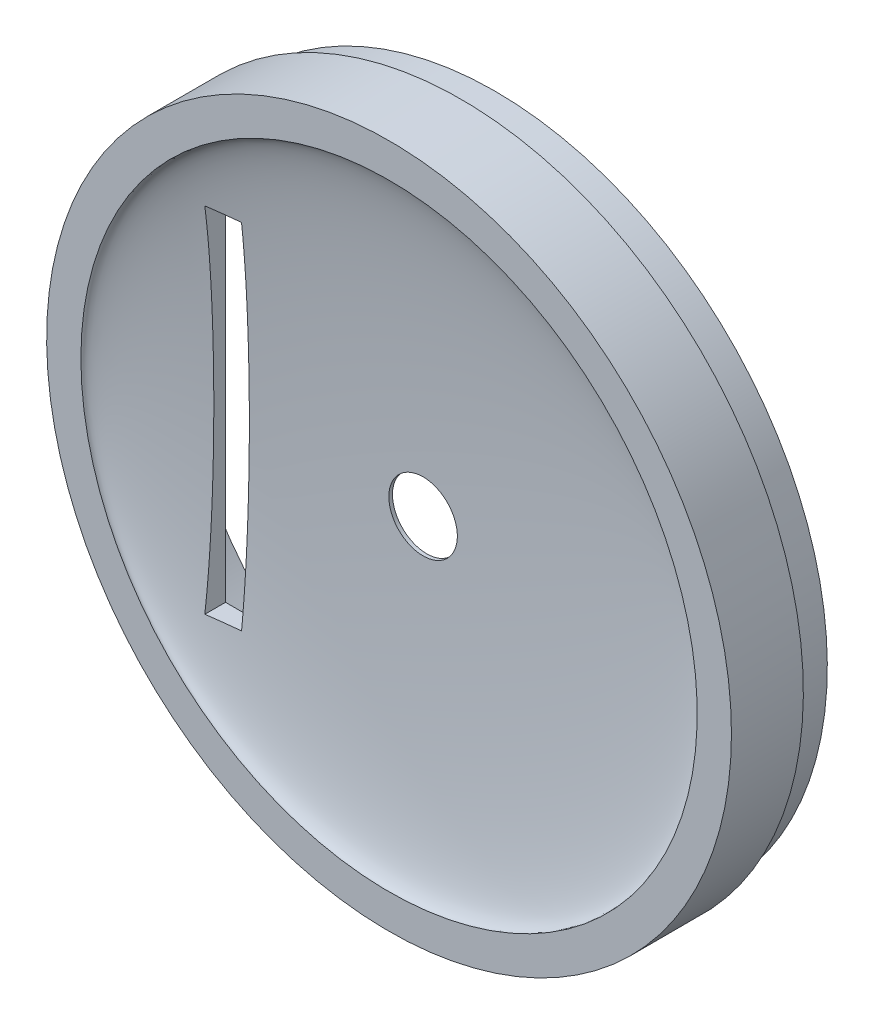
from build123d import *

# Parameters (mm, degrees)
SKETCH_1_R          = 100
EXTRUDE_5_DEPTH     = 10
EXTRUDE_START       = -1
SKETCH_9_R          = 100
EXTRUDE_7_DEPTH     = 1
EXTRUDE_START_2     = 10
SKETCH_11_R         = 100
SKETCH_11_R_2       = 95
EXTRUDE_8_DEPTH     = 10
SKETCH_12_R         = 97
SKETCH_12_R_2       = 95
EXTRUDE_9_DEPTH     = 10
SKETCH_14_R         = 10
SKETCH_14_W         = 9.580387857
SKETCH_14_H         = 103.308515728
CUT_EXTRUDE_4_DEPTH = 20
SKETCH_17_W         = 14.435902612
SKETCH_17_H         = 11
CUT_EXTRUDE_5_DEPTH = 20


with BuildPart() as part:
    # 草图1 → 凸台-拉伸5 (new body)
    with BuildSketch(Plane.XY):
        Circle(SKETCH_1_R)
    extrude(amount=EXTRUDE_5_DEPTH)

    # 草图9 → 凸台-拉伸7 (add)
    with BuildSketch(Plane.XY.offset(EXTRUDE_START)):
        Circle(SKETCH_9_R)
    extrude(amount=EXTRUDE_7_DEPTH)

    # 草图7 → 切除-旋转2 (revolve, cut)
    with BuildSketch(Plane(origin=(0, 0, 0), x_dir=(1, 0, 0), z_dir=(0, 1, 0))):
        with BuildLine():
            Line((0, 0), (0, -10))
            Line((0, -10), (-90, -10))
            add(Edge.make_bspline(
                [(0, 0), (-90, 0), (-90, -10)],
                knots=[1.570796327, 1.570796327, 1.570796327, 3.141592654, 3.141592654, 3.141592654], degree=2, weights=[1, 0.707106781, 1]))
        make_face()
    revolve(axis=Axis((0, 0, 0), (0, 0, 1)), mode=Mode.SUBTRACT)

    # 草图11 → 凸台-拉伸8 (add)
    with BuildSketch(Plane(origin=(0, 0, -1), x_dir=(-1, 0, 0), z_dir=(0, 0, -1)).offset(EXTRUDE_START_2)):
        Circle(SKETCH_11_R)
        Circle(SKETCH_11_R_2, mode=Mode.SUBTRACT)
    extrude(amount=-EXTRUDE_8_DEPTH)

    # 草图12 → 凸台-拉伸9 (add)
    with BuildSketch(Plane(origin=(0, 0, -11), x_dir=(-1, 0, 0), z_dir=(0, 0, -1)).offset(EXTRUDE_START_2)):
        Circle(SKETCH_12_R)
        Circle(SKETCH_12_R_2, mode=Mode.SUBTRACT)
    extrude(amount=-EXTRUDE_9_DEPTH)

    # 草图14 → 切除-拉伸4 (cut)
    with BuildSketch(Plane(origin=(0, 0, -11), x_dir=(-1, 0, 0), z_dir=(0, 0, -1))):
        Circle(SKETCH_14_R)
        with Locations((53.969518264, 0)):
            Rectangle(SKETCH_14_W, SKETCH_14_H)
    extrude(amount=-CUT_EXTRUDE_4_DEPTH, mode=Mode.SUBTRACT)

    # 草图17 → 切除-拉伸5 (cut)
    with BuildSketch(Plane(origin=(0, -100, 0), x_dir=(-1, 0, 0), z_dir=(0, -1, 0))):
        with Locations((-7.217951306, 5.5)):
            Rectangle(SKETCH_17_W, SKETCH_17_H)
        with Locations((7.217951306, 5.5)):
            Rectangle(SKETCH_17_W, SKETCH_17_H)
    extrude(amount=-CUT_EXTRUDE_5_DEPTH, mode=Mode.SUBTRACT)


solid = part.part
